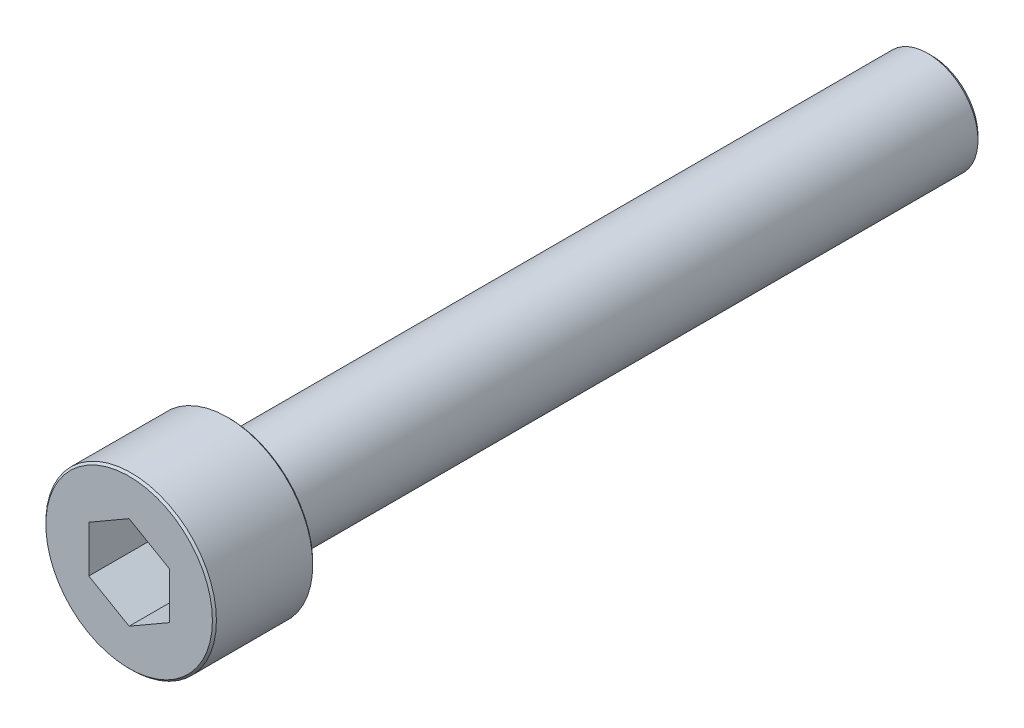
from build123d import *

# Parameters (mm, degrees)
SKETCH_1_W          = 4.25
SKETCH_1_H          = 5
SKETCH_2_R          = 2.5
EXTRUDE_1_DEPTH     = 35
CUT_EXTRUDE_1_DEPTH = 3.75
CHAMFER_1_SIZE2     = 0.100013441
CHAMFER_1_SIZE      = 0.100013125
CHAMFER_2_SIZE      = 0.200056594
CHAMFER_2_SIZE2     = 0.200061517


with BuildPart() as part:
    # 草图1 → 旋转1 (revolve)
    with BuildSketch(Plane(origin=(0, 0, 0), x_dir=(1, 0, 0), z_dir=(0, 1, 0))):
        with Locations((2.125, -37.5)):
            Rectangle(SKETCH_1_W, SKETCH_1_H)
    revolve(axis=Axis((0, 0, 35), (0, 0, 1)))

    # 草图2 → 凸台-拉伸1 (add)
    with BuildSketch(Plane(origin=(0, 0, 35), x_dir=(-1, 0, 0), z_dir=(0, 0, -1))):
        Circle(SKETCH_2_R)
    extrude(amount=EXTRUDE_1_DEPTH)

    # 草图3 → 切除-拉伸1 (cut)
    with BuildSketch(Plane.XY.offset(40)):
        Polygon((-2.01, -1.160474041), (0, -2.320948082), (2.01, -1.160474041), (2.01, 1.160474041), (0, 2.320948082), (-2.01, 1.160474041), align=None)
    extrude(amount=-CUT_EXTRUDE_1_DEPTH, mode=Mode.SUBTRACT)

    # 倒角1
    chamfer_1_edges = [part.edges().sort_by_distance(p)[0] for p in [
        (-4.25, 0, 40),
        (-4.25, 0, 35),
    ]]
    chamfer(chamfer_1_edges, length=CHAMFER_1_SIZE, length2=CHAMFER_1_SIZE2)

    # 倒角2
    chamfer_2_edges = [part.edges().sort_by_distance(p)[0] for p in [
        (2.5, 0, 0),
    ]]
    chamfer_2_side = [part.faces().sort_by_distance(p)[0] for p in [
        (2.5, 0, 17.5),
    ]]
    chamfer(chamfer_2_edges, length=CHAMFER_2_SIZE, length2=CHAMFER_2_SIZE2, reference=chamfer_2_side[0])


solid = part.part
